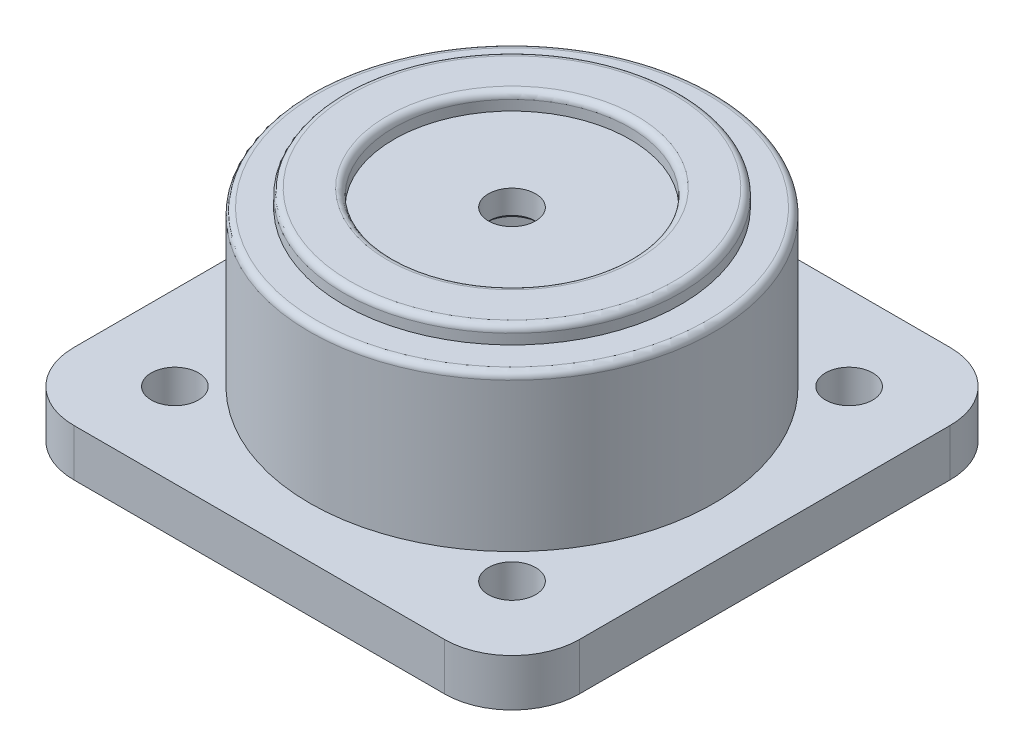
from build123d import *

# Parameters (mm, degrees)
SKETCH_1_R          = 30
EXTRUDE_1_DEPTH     = 30
SKETCH_2_R          = 3.5
EXTRUDE_2_DEPTH     = 7
SKETCH_3_R          = 24
CUT_EXTRUDE_1_DEPTH = 26
SKETCH_4_R          = 3.5
CUT_EXTRUDE_2_DEPTH = 60.063525123
SKETCH_5_R          = 8.5
SKETCH_5_R_2        = 7.5
CUT_EXTRUDE_3_DEPTH = 2.5
CHAMFER_1_SIZE      = 0.5
SKETCH_10_W         = 12
SKETCH_10_H         = 8
CUT_EXTRUDE_4_DEPTH = 49
SKETCH_11_R         = 25
SKETCH_11_R_2       = 17.5
EXTRUDE_3_DEPTH     = 2.5
FILLET_1_R          = 1


with BuildPart() as part:
    # 草图1 → 凸台-拉伸1 (new body)
    with BuildSketch(Plane(origin=(0, 0, 0), x_dir=(1, 0, 0), z_dir=(0, 1, 0))):
        with Locations(Location((0, 0, 0), (0, 0, 270))):
            Circle(SKETCH_1_R)
    extrude(amount=EXTRUDE_1_DEPTH)

    # 草图2 → 凸台-拉伸2 (add)
    with BuildSketch(Plane.XZ):
        with BuildLine():
            Line((-27.5, -37.5), (27.5, -37.5))
            ThreePointArc((27.5, -37.5), (34.571067812, -34.571067812), (37.5, -27.5))
            Line((37.5, -27.5), (37.5, 27.5))
            ThreePointArc((37.5, 27.5), (34.571067812, 34.571067812), (27.5, 37.5))
            Line((27.5, 37.5), (-27.5, 37.5))
            ThreePointArc((-27.5, 37.5), (-34.571067812, 34.571067812), (-37.5, 27.5))
            Line((-37.5, 27.5), (-37.5, -27.5))
            ThreePointArc((-37.5, -27.5), (-34.571067812, -34.571067812), (-27.5, -37.5))
        make_face()
        with Locations(Location((-24.999998784, 24.999998784, 0), (0, 0, 270))):
            Circle(SKETCH_2_R, mode=Mode.SUBTRACT)
        with Locations(Location((-25.000001216, -25.000001216, 0), (0, 0, 270))):
            Circle(SKETCH_2_R, mode=Mode.SUBTRACT)
        with Locations(Location((25.000001216, 25.000001216, 0), (0, 0, 270))):
            Circle(SKETCH_2_R, mode=Mode.SUBTRACT)
        with Locations(Location((24.999998784, -24.999998784, 0), (0, 0, 270))):
            Circle(SKETCH_2_R, mode=Mode.SUBTRACT)
    extrude(amount=-EXTRUDE_2_DEPTH)

    # 草图3 → 切除-拉伸1 (cut)
    with BuildSketch(Plane.XZ):
        with Locations(Location((0, 0, 0), (0, 0, 270))):
            Circle(SKETCH_3_R)
    extrude(amount=-CUT_EXTRUDE_1_DEPTH, mode=Mode.SUBTRACT)

    # 草图4 → 切除-拉伸2 (cut, through all)
    with BuildSketch(Plane.XZ.offset(-26)):
        with Locations(Location((0, 0, 0), (0, 0, 270))):
            Circle(SKETCH_4_R)
    extrude(amount=-CUT_EXTRUDE_2_DEPTH, mode=Mode.SUBTRACT)

    # 草图5 → 切除-拉伸3 (cut)
    with BuildSketch(Plane.XZ.offset(-26)):
        with Locations(Location((0, 0, 0), (0, 0, 270))):
            Circle(SKETCH_5_R)
        with Locations(Location((0, 0, 0), (0, 0, 270))):
            Circle(SKETCH_5_R_2, mode=Mode.SUBTRACT)
    extrude(amount=-CUT_EXTRUDE_3_DEPTH, mode=Mode.SUBTRACT)

    # 倒角1
    chamfer_1_edges = [part.edges().sort_by_distance(p)[0] for p in [
        (0, 26, 3.5),
    ]]
    chamfer(chamfer_1_edges, length=CHAMFER_1_SIZE)

    # 草图10 → 切除-拉伸4 (cut)
    with BuildSketch(Plane.XY):
        with Locations((0, 19)):
            Rectangle(SKETCH_10_W, SKETCH_10_H)
    extrude(amount=-CUT_EXTRUDE_4_DEPTH, mode=Mode.SUBTRACT)

    # 草图11 → 凸台-拉伸3 (add)
    with BuildSketch(Plane(origin=(0, 30, 0), x_dir=(1, 0, 0), z_dir=(0, 1, 0))):
        with Locations(Location((0, 0, 0), (0, 0, 270))):
            Circle(SKETCH_11_R)
        with Locations(Location((0, 0, 0), (0, 0, 270))):
            Circle(SKETCH_11_R_2, mode=Mode.SUBTRACT)
    extrude(amount=EXTRUDE_3_DEPTH)

    # 圆角1
    fillet_1_edges = [part.edges().sort_by_distance(p)[0] for p in [
        (0, 30, -30),
        (0, 32.5, -25),
        (0, 32.5, -17.5),
    ]]
    fillet(fillet_1_edges, radius=FILLET_1_R)


solid = part.part
